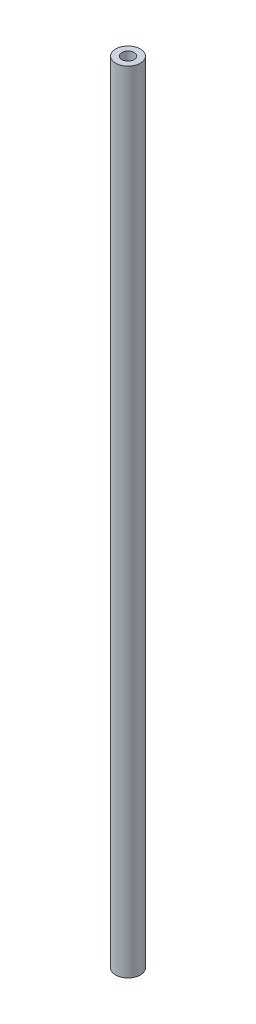
from build123d import *

# Parameters (mm, degrees)
SKETCH1_R           = 3.175
SKETCH1_R_2         = 1.5875
BOSS_EXTRUDE1_DEPTH = 203.2


with BuildPart() as part:
    # Sketch1 → Boss-Extrude1 (new body)
    with BuildSketch(Plane(origin=(0, 0, 0), x_dir=(1, 0, 0), z_dir=(0, 1, 0))):
        with Locations(Location((0, 0, 0), (0, 0, 270))):
            Circle(SKETCH1_R)
        with Locations(Location((0, 0, 0), (0, 0, 270))):
            Circle(SKETCH1_R_2, mode=Mode.SUBTRACT)
    extrude(amount=BOSS_EXTRUDE1_DEPTH)


solid = part.part
